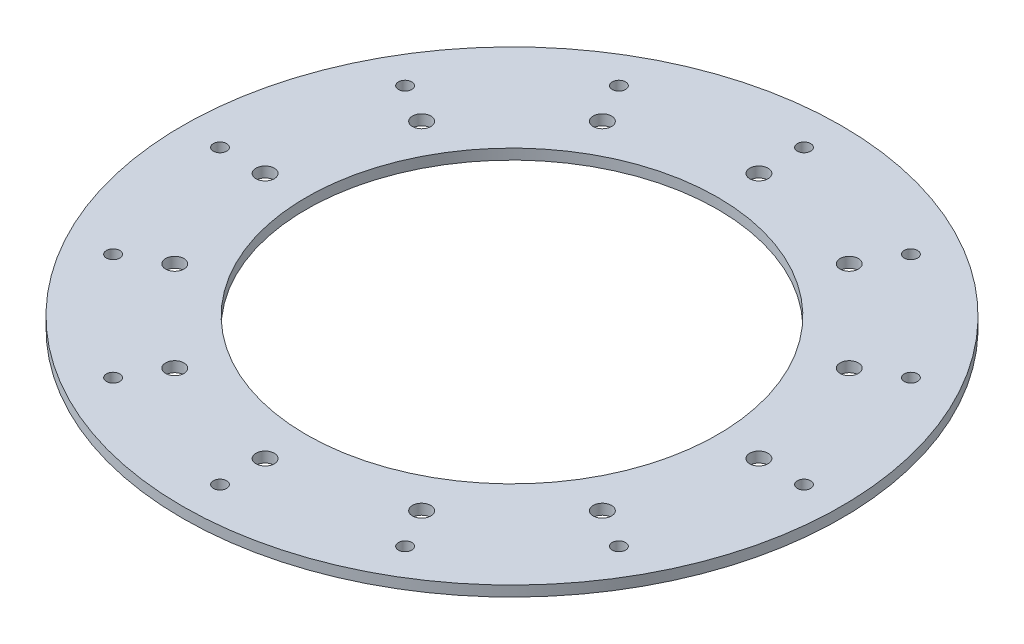
from build123d import *

# Parameters (mm, degrees)
SKETCH1_R           = 79
SKETCH1_R_2         = 49.3
BOSS_EXTRUDE1_DEPTH = 2.5
SKETCH2_R           = 1.6
CUT_EXTRUDE1_DEPTH  = 112.750838923
SKETCH3_R           = 2.2
CUT_EXTRUDE2_DEPTH  = 112.750838923


with BuildPart() as part:
    # Sketch1 → Boss-Extrude1 (new body)
    with BuildSketch(Plane(origin=(0, 0, 0), x_dir=(1, 0, 0), z_dir=(0, 1, 0))):
        with Locations(Location((0, 0, 0), (0, 0, 270))):
            Circle(SKETCH1_R)
        with Locations(Location((0, 0, 0), (0, 0, 270))):
            Circle(SKETCH1_R_2, mode=Mode.SUBTRACT)
    extrude(amount=BOSS_EXTRUDE1_DEPTH)

    # Sketch2 → Cut-Extrude1 (cut, through all)
    with BuildSketch(Plane(origin=(0, 2.5, 0), x_dir=(1, 0, 0), z_dir=(0, 1, 0))):
        with Locations(Location((0, 70, 0), (0, 0, 270))):
            Circle(SKETCH2_R)
        with Locations(Location((35, 60.621778265, 0), (0, 0, 270))):
            Circle(SKETCH2_R)
        with Locations(Location((60.621778265, 35, 0), (0, 0, 270))):
            Circle(SKETCH2_R)
        with Locations(Location((70, 0, 0), (0, 0, 270))):
            Circle(SKETCH2_R)
        with Locations(Location((60.621778265, -35, 0), (0, 0, 270))):
            Circle(SKETCH2_R)
        with Locations(Location((35, -60.621778265, 0), (0, 0, 270))):
            Circle(SKETCH2_R)
        with Locations(Location((0, -70, 0), (0, 0, 270))):
            Circle(SKETCH2_R)
        with Locations(Location((-35, -60.621778265, 0), (0, 0, 270))):
            Circle(SKETCH2_R)
        with Locations(Location((-60.621778265, -35, 0), (0, 0, 270))):
            Circle(SKETCH2_R)
        with Locations(Location((-70, 0, 0), (0, 0, 270))):
            Circle(SKETCH2_R)
        with Locations(Location((-60.621778265, 35, 0), (0, 0, 270))):
            Circle(SKETCH2_R)
        with Locations(Location((-35, 60.621778265, 0), (0, 0, 270))):
            Circle(SKETCH2_R)
    extrude(amount=-CUT_EXTRUDE1_DEPTH, mode=Mode.SUBTRACT)

    # Sketch3 → Cut-Extrude2 (cut, through all)
    with BuildSketch(Plane(origin=(0, 2.5, 0), x_dir=(1, 0, 0), z_dir=(0, 1, 0))):
        with Locations(Location((0, 59.18, 0), (0, 0, 270))):
            Circle(SKETCH3_R)
        with Locations(Location((29.59, 51.251383396, 0), (0, 0, 270))):
            Circle(SKETCH3_R)
        with Locations(Location((51.251383396, 29.59, 0), (0, 0, 270))):
            Circle(SKETCH3_R)
        with Locations(Location((59.18, 0, 0), (0, 0, 270))):
            Circle(SKETCH3_R)
        with Locations(Location((51.251383396, -29.59, 0), (0, 0, 270))):
            Circle(SKETCH3_R)
        with Locations(Location((29.59, -51.251383396, 0), (0, 0, 270))):
            Circle(SKETCH3_R)
        with Locations(Location((0, -59.18, 0), (0, 0, 270))):
            Circle(SKETCH3_R)
        with Locations(Location((-29.59, -51.251383396, 0), (0, 0, 270))):
            Circle(SKETCH3_R)
        with Locations(Location((-51.251383396, -29.59, 0), (0, 0, 270))):
            Circle(SKETCH3_R)
        with Locations(Location((-59.18, 0, 0), (0, 0, 270))):
            Circle(SKETCH3_R)
        with Locations(Location((-51.251383396, 29.59, 0), (0, 0, 270))):
            Circle(SKETCH3_R)
        with Locations(Location((-29.59, 51.251383396, 0), (0, 0, 270))):
            Circle(SKETCH3_R)
    extrude(amount=-CUT_EXTRUDE2_DEPTH, mode=Mode.SUBTRACT)


solid = part.part
